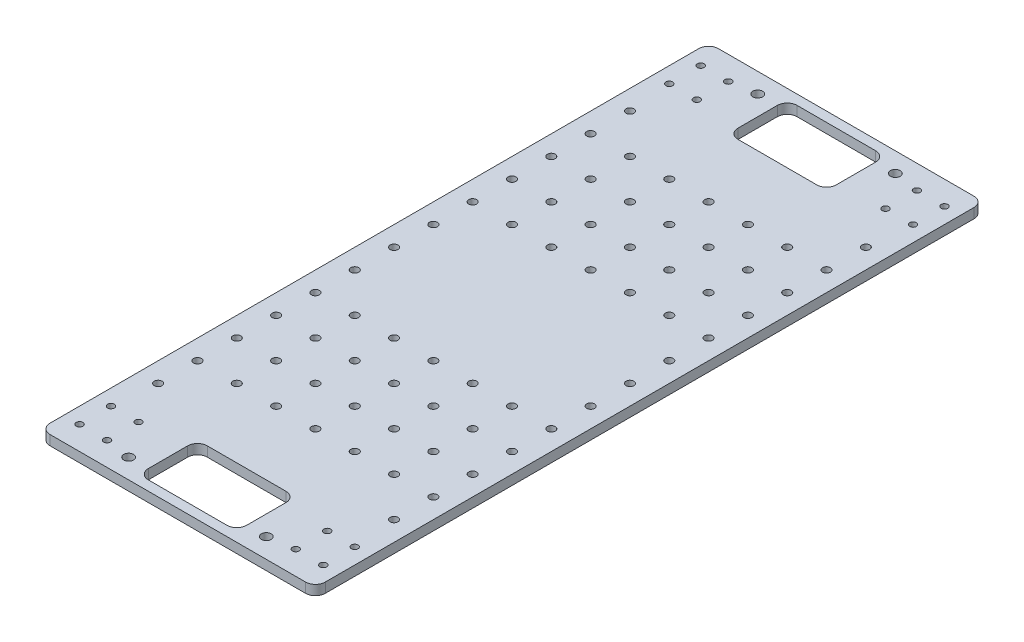
from build123d import *

# Parameters (mm, degrees)
SKETCH_1_R      = 1.7
SKETCH_1_R_2    = 2.5
SKETCH_1_R_3    = 2
EXTRUDE_2_DEPTH = 5


with BuildPart() as part:
    # 草图1 → 凸台-拉伸2 (new body)
    with BuildSketch(Plane(origin=(0, 0, 0), x_dir=(1, 0, 0), z_dir=(0, 1, 0))):
        with BuildLine():
            ThreePointArc((-65, 170), (-68.535533906, 168.535533906), (-70, 165))
            Line((-70, 165), (-70, 130))
            Line((-70, 130), (-70, -165))
            ThreePointArc((-70, -165), (-68.535533906, -168.535533906), (-65, -170))
            Line((-65, -170), (65, -170))
            ThreePointArc((65, -170), (68.535533906, -168.535533906), (70, -165))
            Line((70, -165), (70, 165))
            ThreePointArc((70, 165), (68.535533906, 168.535533906), (65, 170))
            Line((65, 170), (0, 170))
            Line((0, 170), (-65, 170))
        make_face()
        with Locations(Location((-62, -158, 0), (0, 0, 270))):
            Circle(SKETCH_1_R, mode=Mode.SUBTRACT)
        with Locations(Location((-48, -158, 0), (0, 0, 270))):
            Circle(SKETCH_1_R, mode=Mode.SUBTRACT)
        with Locations(Location((-62, -142, 0), (0, 0, 270))):
            Circle(SKETCH_1_R, mode=Mode.SUBTRACT)
        with Locations(Location((-48, -142, 0), (0, 0, 270))):
            Circle(SKETCH_1_R, mode=Mode.SUBTRACT)
        with Locations(Location((-35, -160, 0), (0, 0, 270))):
            Circle(SKETCH_1_R_2, mode=Mode.SUBTRACT)
        with Locations(Location((-60, -120, 0), (0, 0, 270))):
            Circle(SKETCH_1_R_3, mode=Mode.SUBTRACT)
        with Locations(Location((-60, -100, 0), (0, 0, 270))):
            Circle(SKETCH_1_R_3, mode=Mode.SUBTRACT)
        with Locations(Location((-40, -100, 0), (0, 0, 270))):
            Circle(SKETCH_1_R_3, mode=Mode.SUBTRACT)
        with Locations(Location((-20, -100, 0), (0, 0, 270))):
            Circle(SKETCH_1_R_3, mode=Mode.SUBTRACT)
        with Locations(Location((-60, -80, 0), (0, 0, 270))):
            Circle(SKETCH_1_R_3, mode=Mode.SUBTRACT)
        with Locations(Location((-60, -60, 0), (0, 0, 270))):
            Circle(SKETCH_1_R_3, mode=Mode.SUBTRACT)
        with Locations(Location((-40, -80, 0), (0, 0, 270))):
            Circle(SKETCH_1_R_3, mode=Mode.SUBTRACT)
        with Locations(Location((-40, -60, 0), (0, 0, 270))):
            Circle(SKETCH_1_R_3, mode=Mode.SUBTRACT)
        with Locations(Location((-60, -40, 0), (0, 0, 270))):
            Circle(SKETCH_1_R_3, mode=Mode.SUBTRACT)
        with Locations(Location((-60, -20, 0), (0, 0, 270))):
            Circle(SKETCH_1_R_3, mode=Mode.SUBTRACT)
        with Locations(Location((-60, 0, 0), (0, 0, 270))):
            Circle(SKETCH_1_R_3, mode=Mode.SUBTRACT)
        with Locations(Location((-40, -40, 0), (0, 0, 270))):
            Circle(SKETCH_1_R_3, mode=Mode.SUBTRACT)
        with Locations(Location((-20, -80, 0), (0, 0, 270))):
            Circle(SKETCH_1_R_3, mode=Mode.SUBTRACT)
        with Locations(Location((-20, -60, 0), (0, 0, 270))):
            Circle(SKETCH_1_R_3, mode=Mode.SUBTRACT)
        with Locations(Location((-20, -40, 0), (0, 0, 270))):
            Circle(SKETCH_1_R_3, mode=Mode.SUBTRACT)
        with BuildLine():
            Line((25, -140), (25, -160))
            ThreePointArc((25, -160), (23.535533906, -163.535533906), (20, -165))
            Line((20, -165), (-20, -165))
            ThreePointArc((-20, -165), (-23.535533906, -163.535533906), (-25, -160))
            Line((-25, -160), (-25, -140))
            ThreePointArc((-25, -140), (-23.535533906, -136.464466094), (-20, -135))
            Line((-20, -135), (20, -135))
            ThreePointArc((20, -135), (23.535533906, -136.464466094), (25, -140))
        make_face(mode=Mode.SUBTRACT)
        with Locations(Location((0, -100, 0), (0, 0, 270))):
            Circle(SKETCH_1_R_3, mode=Mode.SUBTRACT)
        with Locations(Location((20, -100, 0), (0, 0, 270))):
            Circle(SKETCH_1_R_3, mode=Mode.SUBTRACT)
        with Locations(Location((35, -160, 0), (0, 0, 270))):
            Circle(SKETCH_1_R_2, mode=Mode.SUBTRACT)
        with Locations(Location((48, -158, 0), (0, 0, 270))):
            Circle(SKETCH_1_R, mode=Mode.SUBTRACT)
        with Locations(Location((62, -158, 0), (0, 0, 270))):
            Circle(SKETCH_1_R, mode=Mode.SUBTRACT)
        with Locations(Location((48, -142, 0), (0, 0, 270))):
            Circle(SKETCH_1_R, mode=Mode.SUBTRACT)
        with Locations(Location((62, -142, 0), (0, 0, 270))):
            Circle(SKETCH_1_R, mode=Mode.SUBTRACT)
        with Locations(Location((40, -100, 0), (0, 0, 270))):
            Circle(SKETCH_1_R_3, mode=Mode.SUBTRACT)
        with Locations(Location((60, -120, 0), (0, 0, 270))):
            Circle(SKETCH_1_R_3, mode=Mode.SUBTRACT)
        with Locations(Location((60, -100, 0), (0, 0, 270))):
            Circle(SKETCH_1_R_3, mode=Mode.SUBTRACT)
        with Locations(Location((0, -80, 0), (0, 0, 270))):
            Circle(SKETCH_1_R_3, mode=Mode.SUBTRACT)
        with Locations(Location((0, -60, 0), (0, 0, 270))):
            Circle(SKETCH_1_R_3, mode=Mode.SUBTRACT)
        with Locations(Location((20, -80, 0), (0, 0, 270))):
            Circle(SKETCH_1_R_3, mode=Mode.SUBTRACT)
        with Locations(Location((20, -60, 0), (0, 0, 270))):
            Circle(SKETCH_1_R_3, mode=Mode.SUBTRACT)
        with Locations(Location((0, -40, 0), (0, 0, 270))):
            Circle(SKETCH_1_R_3, mode=Mode.SUBTRACT)
        with Locations(Location((20, -40, 0), (0, 0, 270))):
            Circle(SKETCH_1_R_3, mode=Mode.SUBTRACT)
        with Locations(Location((40, -80, 0), (0, 0, 270))):
            Circle(SKETCH_1_R_3, mode=Mode.SUBTRACT)
        with Locations(Location((40, -60, 0), (0, 0, 270))):
            Circle(SKETCH_1_R_3, mode=Mode.SUBTRACT)
        with Locations(Location((60, -80, 0), (0, 0, 270))):
            Circle(SKETCH_1_R_3, mode=Mode.SUBTRACT)
        with Locations(Location((60, -60, 0), (0, 0, 270))):
            Circle(SKETCH_1_R_3, mode=Mode.SUBTRACT)
        with Locations(Location((40, -40, 0), (0, 0, 270))):
            Circle(SKETCH_1_R_3, mode=Mode.SUBTRACT)
        with Locations(Location((60, -40, 0), (0, 0, 270))):
            Circle(SKETCH_1_R_3, mode=Mode.SUBTRACT)
        with Locations(Location((60, -20, 0), (0, 0, 270))):
            Circle(SKETCH_1_R_3, mode=Mode.SUBTRACT)
        with Locations(Location((-60, 20, 0), (0, 0, 270))):
            Circle(SKETCH_1_R_3, mode=Mode.SUBTRACT)
        with Locations(Location((-60, 40, 0), (0, 0, 270))):
            Circle(SKETCH_1_R_3, mode=Mode.SUBTRACT)
        with Locations(Location((-40, 40, 0), (0, 0, 270))):
            Circle(SKETCH_1_R_3, mode=Mode.SUBTRACT)
        with Locations(Location((-60, 60, 0), (0, 0, 270))):
            Circle(SKETCH_1_R_3, mode=Mode.SUBTRACT)
        with Locations(Location((-60, 80, 0), (0, 0, 270))):
            Circle(SKETCH_1_R_3, mode=Mode.SUBTRACT)
        with Locations(Location((-40, 60, 0), (0, 0, 270))):
            Circle(SKETCH_1_R_3, mode=Mode.SUBTRACT)
        with Locations(Location((-40, 80, 0), (0, 0, 270))):
            Circle(SKETCH_1_R_3, mode=Mode.SUBTRACT)
        with Locations(Location((-20, 40, 0), (0, 0, 270))):
            Circle(SKETCH_1_R_3, mode=Mode.SUBTRACT)
        with Locations(Location((-20, 60, 0), (0, 0, 270))):
            Circle(SKETCH_1_R_3, mode=Mode.SUBTRACT)
        with Locations(Location((-20, 80, 0), (0, 0, 270))):
            Circle(SKETCH_1_R_3, mode=Mode.SUBTRACT)
        with Locations(Location((-60, 100, 0), (0, 0, 270))):
            Circle(SKETCH_1_R_3, mode=Mode.SUBTRACT)
        with Locations(Location((-60, 120, 0), (0, 0, 270))):
            Circle(SKETCH_1_R_3, mode=Mode.SUBTRACT)
        with Locations(Location((-40, 100, 0), (0, 0, 270))):
            Circle(SKETCH_1_R_3, mode=Mode.SUBTRACT)
        with Locations(Location((-62, 142, 0), (0, 0, 270))):
            Circle(SKETCH_1_R, mode=Mode.SUBTRACT)
        with Locations(Location((-48, 142, 0), (0, 0, 270))):
            Circle(SKETCH_1_R, mode=Mode.SUBTRACT)
        with Locations(Location((-62, 158, 0), (0, 0, 270))):
            Circle(SKETCH_1_R, mode=Mode.SUBTRACT)
        with Locations(Location((-48, 158, 0), (0, 0, 270))):
            Circle(SKETCH_1_R, mode=Mode.SUBTRACT)
        with Locations(Location((-35, 160, 0), (0, 0, 270))):
            Circle(SKETCH_1_R_2, mode=Mode.SUBTRACT)
        with Locations(Location((-20, 100, 0), (0, 0, 270))):
            Circle(SKETCH_1_R_3, mode=Mode.SUBTRACT)
        with Locations(Location((0, 40, 0), (0, 0, 270))):
            Circle(SKETCH_1_R_3, mode=Mode.SUBTRACT)
        with Locations(Location((20, 40, 0), (0, 0, 270))):
            Circle(SKETCH_1_R_3, mode=Mode.SUBTRACT)
        with Locations(Location((0, 60, 0), (0, 0, 270))):
            Circle(SKETCH_1_R_3, mode=Mode.SUBTRACT)
        with Locations(Location((0, 80, 0), (0, 0, 270))):
            Circle(SKETCH_1_R_3, mode=Mode.SUBTRACT)
        with Locations(Location((20, 60, 0), (0, 0, 270))):
            Circle(SKETCH_1_R_3, mode=Mode.SUBTRACT)
        with Locations(Location((20, 80, 0), (0, 0, 270))):
            Circle(SKETCH_1_R_3, mode=Mode.SUBTRACT)
        with Locations(Location((40, 40, 0), (0, 0, 270))):
            Circle(SKETCH_1_R_3, mode=Mode.SUBTRACT)
        with Locations(Location((60, 0, 0), (0, 0, 270))):
            Circle(SKETCH_1_R_3, mode=Mode.SUBTRACT)
        with Locations(Location((60, 20, 0), (0, 0, 270))):
            Circle(SKETCH_1_R_3, mode=Mode.SUBTRACT)
        with Locations(Location((60, 40, 0), (0, 0, 270))):
            Circle(SKETCH_1_R_3, mode=Mode.SUBTRACT)
        with Locations(Location((40, 60, 0), (0, 0, 270))):
            Circle(SKETCH_1_R_3, mode=Mode.SUBTRACT)
        with Locations(Location((40, 80, 0), (0, 0, 270))):
            Circle(SKETCH_1_R_3, mode=Mode.SUBTRACT)
        with Locations(Location((60, 60, 0), (0, 0, 270))):
            Circle(SKETCH_1_R_3, mode=Mode.SUBTRACT)
        with Locations(Location((60, 80, 0), (0, 0, 270))):
            Circle(SKETCH_1_R_3, mode=Mode.SUBTRACT)
        with Locations(Location((0, 100, 0), (0, 0, 270))):
            Circle(SKETCH_1_R_3, mode=Mode.SUBTRACT)
        with Locations(Location((20, 100, 0), (0, 0, 270))):
            Circle(SKETCH_1_R_3, mode=Mode.SUBTRACT)
        with BuildLine():
            Line((-20, 165), (0, 165))
            Line((0, 165), (20, 165))
            ThreePointArc((20, 165), (23.535533906, 163.535533906), (25, 160))
            Line((25, 160), (25, 140))
            ThreePointArc((25, 140), (23.535533906, 136.464466094), (20, 135))
            Line((20, 135), (-20, 135))
            ThreePointArc((-20, 135), (-23.535533906, 136.464466094), (-25, 140))
            Line((-25, 140), (-25, 160))
            ThreePointArc((-25, 160), (-23.535533906, 163.535533906), (-20, 165))
        make_face(mode=Mode.SUBTRACT)
        with Locations(Location((40, 100, 0), (0, 0, 270))):
            Circle(SKETCH_1_R_3, mode=Mode.SUBTRACT)
        with Locations(Location((60, 100, 0), (0, 0, 270))):
            Circle(SKETCH_1_R_3, mode=Mode.SUBTRACT)
        with Locations(Location((60, 120, 0), (0, 0, 270))):
            Circle(SKETCH_1_R_3, mode=Mode.SUBTRACT)
        with Locations(Location((35, 160, 0), (0, 0, 270))):
            Circle(SKETCH_1_R_2, mode=Mode.SUBTRACT)
        with Locations(Location((48, 142, 0), (0, 0, 270))):
            Circle(SKETCH_1_R, mode=Mode.SUBTRACT)
        with Locations(Location((62, 142, 0), (0, 0, 270))):
            Circle(SKETCH_1_R, mode=Mode.SUBTRACT)
        with Locations(Location((48, 158, 0), (0, 0, 270))):
            Circle(SKETCH_1_R, mode=Mode.SUBTRACT)
        with Locations(Location((62, 158, 0), (0, 0, 270))):
            Circle(SKETCH_1_R, mode=Mode.SUBTRACT)
    extrude(amount=EXTRUDE_2_DEPTH)


solid = part.part
